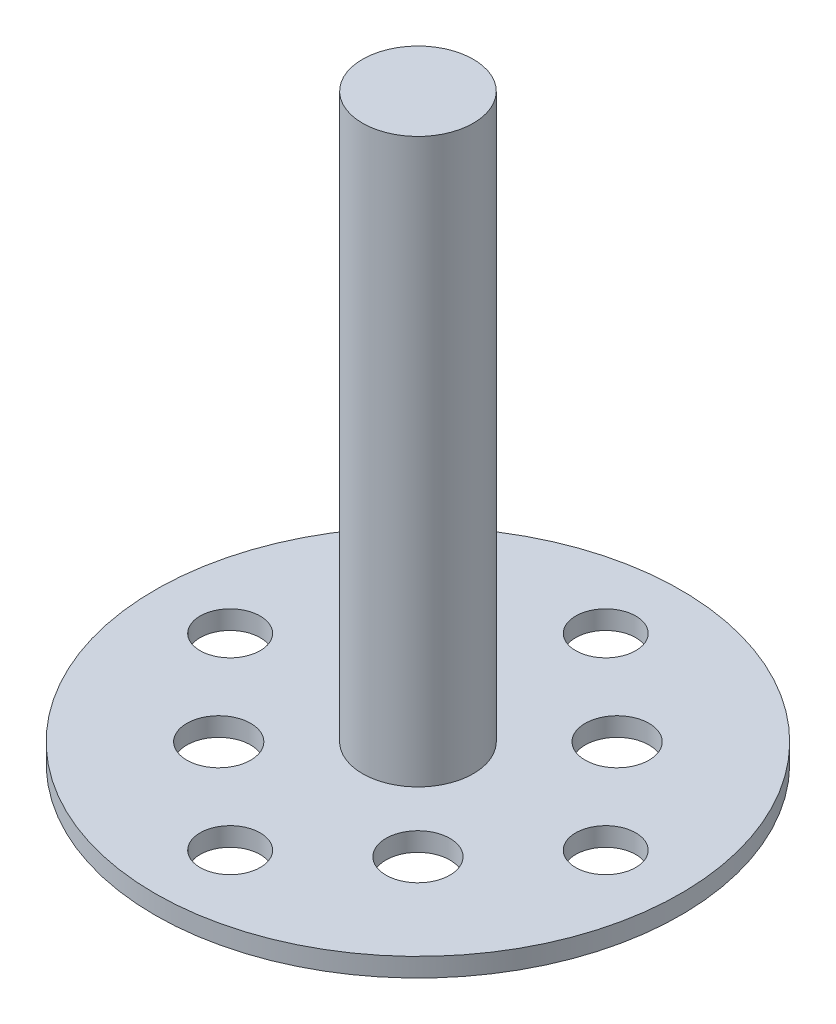
from build123d import *

# Parameters (mm, degrees)
SKETCH1_R           = 14
SKETCH1_R_2         = 1.6
SKETCH1_R_3         = 1.7
SKETCH1_R_4         = 2.95
BOSS_EXTRUDE1_DEPTH = 1
SKETCH1_3_R         = 2.95
BOSS_EXTRUDE2_DEPTH = 31


with BuildPart() as part:
    # Sketch1 → Boss-Extrude1 (new body)
    with BuildSketch(Plane(origin=(0, 0, 0), x_dir=(1, 0, 0), z_dir=(0, 1, 0))):
        Circle(SKETCH1_R)
        with Locations((0, 10)):
            Circle(SKETCH1_R_2, mode=Mode.SUBTRACT)
        with Locations((-10, 0)):
            Circle(SKETCH1_R_2, mode=Mode.SUBTRACT)
        with Locations((0, -10)):
            Circle(SKETCH1_R_2, mode=Mode.SUBTRACT)
        with Locations((10, 0)):
            Circle(SKETCH1_R_2, mode=Mode.SUBTRACT)
        with Locations((5.303300859, -5.303300859)):
            Circle(SKETCH1_R_3, mode=Mode.SUBTRACT)
        with Locations((-5.303300859, 5.303300859)):
            Circle(SKETCH1_R_3, mode=Mode.SUBTRACT)
        Circle(SKETCH1_R_4, mode=Mode.SUBTRACT)
        with Locations((5.303300859, 5.303300859)):
            Circle(SKETCH1_R_3, mode=Mode.SUBTRACT)
        with Locations((-5.303300859, -5.303300859)):
            Circle(SKETCH1_R_3, mode=Mode.SUBTRACT)
    extrude(amount=BOSS_EXTRUDE1_DEPTH)

    # Sketch1<3> → Boss-Extrude2 (add)
    with BuildSketch(Plane(origin=(0, 0, 0), x_dir=(1, 0, 0), z_dir=(0, 1, 0))):
        Circle(SKETCH1_3_R)
    extrude(amount=BOSS_EXTRUDE2_DEPTH)


solid = part.part
